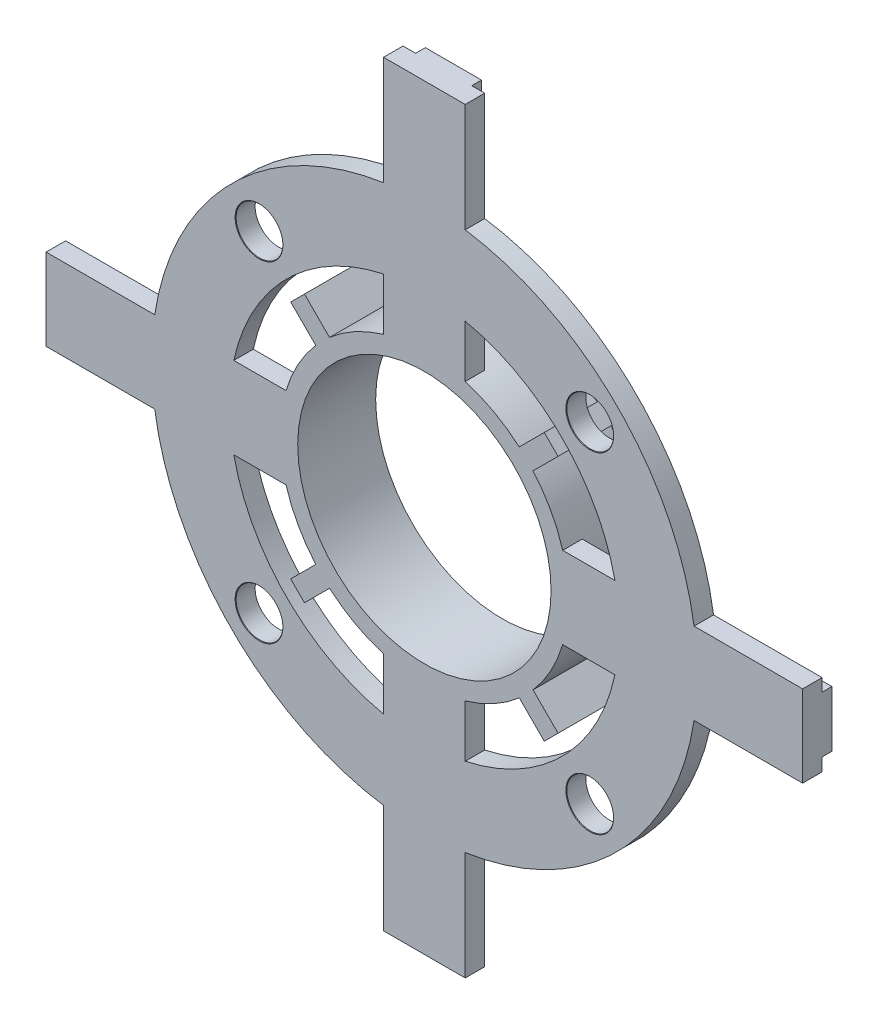
from build123d import *

# Parameters (mm, degrees)
BOSS_EXTRUDE1_DEPTH            = 1.0000005
BOSS_EXTRUDE1_DEPTH_BACK       = 3
SKETCH1_R                      = 7.4
SKETCH1_R_2                    = 6.5
BOSS_EXTRUDE2_DEPTH            = 1.0000005
BOSS_EXTRUDE12_START           = -3
BOSS_EXTRUDE12_DEPTH           = 4.000001
SKETCH6_W                      = 2.880295876
SKETCH6_H                      = 10.5
BOSS_EXTRUDE8_DEPTH            = 0.5
CIRPATTERN3_COUNT              = 4
SKETCH7_R                      = 14
SKETCH7_R_2                    = 10
BOSS_EXTRUDE10_DEPTH           = 1.0000005
M2_CLEARANCE_HOLE1_D           = 2.4
M2_CLEARANCE_HOLE1_CSINK_D     = 2.45
M2_CLEARANCE_HOLE1_CSINK_ANGLE = 90
CUT_EXTRUDE1_DEPTH             = 28.738141627


with BuildPart() as part:
    # Sketch1 → Boss-Extrude1 (new, two sides: drawn at the far end of the back side and taken through both)
    with BuildSketch(Plane.XY.offset(-BOSS_EXTRUDE1_DEPTH_BACK)):
        Circle(SKETCH1_R)
        Circle(SKETCH1_R_2, mode=Mode.SUBTRACT)
    extrude(amount=BOSS_EXTRUDE1_DEPTH + BOSS_EXTRUDE1_DEPTH_BACK)

    # Sketch2 → Boss-Extrude2 (add)
    with BuildSketch(Plane.XY.offset(1.0000005)):
        with BuildLine():
            ThreePointArc((2.0955, -15.598818832), (6.979767945, -14.106633498), (11.129112031, -11.129112031))
            ThreePointArc((11.129112031, -11.129112031), (14.106633498, -6.979767945), (15.598818832, -2.0955))
            Line((15.598818832, -2.0955), (19.408818832, -2.0955))
            Line((19.408818832, -2.0955), (19.408818832, 2.0955))
            Line((19.408818832, 2.0955), (15.598818832, 2.0955))
            ThreePointArc((15.598818832, 2.0955), (11.129112031, 11.129112031), (2.0955, 15.598818832))
            Line((2.0955, 15.598818832), (2.0955, 19.408818832))
            Line((2.0955, 19.408818832), (-2.0955, 19.408818832))
            Line((-2.0955, 19.408818832), (-2.0955, 15.598818832))
            ThreePointArc((-2.0955, 15.598818832), (-11.129112031, 11.129112031), (-15.598818832, 2.0955))
            Line((-15.598818832, 2.0955), (-19.408818832, 2.0955))
            Line((-19.408818832, 2.0955), (-19.408818832, -2.0955))
            Line((-19.408818832, -2.0955), (-15.598818832, -2.0955))
            ThreePointArc((-15.598818832, -2.0955), (-11.129112031, -11.129112031), (-2.0955, -15.598818832))
            Line((-2.0955, -15.598818832), (-2.0955, -19.408818832))
            Line((-2.0955, -19.408818832), (2.0955, -19.408818832))
            Line((2.0955, -19.408818832), (2.0955, -15.598818832))
        make_face()
        with BuildLine():
            ThreePointArc((7.4, 0), (7.323884446, -1.05863904), (7.097103617, -2.0955))
            Line((7.097103617, -2.0955), (13.031535896, -2.0955))
            ThreePointArc((13.031535896, -2.0955), (11.753270525, -6.006053615), (9.333060807, -9.333060807))
            ThreePointArc((9.333060807, -9.333060807), (6.006053615, -11.753270525), (2.0955, -13.031535896))
            Line((2.0955, -13.031535896), (2.0955, -7.097103617))
            ThreePointArc((2.0955, -7.097103617), (0, -7.4), (-2.0955, -7.097103617))
            Line((-2.0955, -7.097103617), (-2.0955, -13.031535896))
            ThreePointArc((-2.0955, -13.031535896), (-9.333060807, -9.333060807), (-13.031535896, -2.0955))
            Line((-13.031535896, -2.0955), (-7.097103617, -2.0955))
            ThreePointArc((-7.097103617, -2.0955), (-7.4, 0), (-7.097103617, 2.0955))
            Line((-7.097103617, 2.0955), (-13.031535896, 2.0955))
            ThreePointArc((-13.031535896, 2.0955), (-9.333060807, 9.333060807), (-2.0955, 13.031535896))
            Line((-2.0955, 13.031535896), (-2.0955, 7.097103617))
            ThreePointArc((-2.0955, 7.097103617), (0, 7.4), (2.0955, 7.097103617))
            Line((2.0955, 7.097103617), (2.0955, 13.031535896))
            ThreePointArc((2.0955, 13.031535896), (9.333060807, 9.333060807), (13.031535896, 2.0955))
            Line((13.031535896, 2.0955), (7.097103617, 2.0955))
            ThreePointArc((7.097103617, 2.0955), (7.323884446, 1.05863904), (7.4, 0))
        make_face(mode=Mode.SUBTRACT)
    extrude(amount=-BOSS_EXTRUDE2_DEPTH)

    # Sketch3 → Boss-Extrude12 (add)
    with BuildSketch(Plane.XY.offset(BOSS_EXTRUDE12_START)):
        with BuildLine():
            ThreePointArc((4.867078755, 5.574185536), (4.880275394, 5.562635354), (4.893444623, 5.551053929))
            ThreePointArc((4.893444623, 5.551053929), (5.244976244, 5.220174729), (5.574185536, 4.867078755))
            Line((5.574185536, 4.867078755), (6.858935778, 6.151828996))
            Line((6.858935778, 6.151828996), (6.151828996, 6.858935778))
            Line((6.151828996, 6.858935778), (4.867078755, 5.574185536))
        make_face()
        with BuildLine():
            ThreePointArc((-4.893444623, 5.551053929), (-4.880275394, 5.562635354), (-4.867078755, 5.574185536))
            Line((-4.867078755, 5.574185536), (-6.151828996, 6.858935778))
            Line((-6.151828996, 6.858935778), (-6.858935778, 6.151828996))
            Line((-6.858935778, 6.151828996), (-5.574185536, 4.867078755))
            ThreePointArc((-5.574185536, 4.867078755), (-5.244976244, 5.220174729), (-4.893444623, 5.551053929))
        make_face()
        with BuildLine():
            Line((6.858935778, -6.151828996), (5.574185536, -4.867078755))
            ThreePointArc((5.574185536, -4.867078755), (5.232590181, -5.232590181), (4.867078755, -5.574185536))
            Line((4.867078755, -5.574185536), (6.151828996, -6.858935778))
            Line((6.151828996, -6.858935778), (6.858935778, -6.151828996))
        make_face()
        with BuildLine():
            ThreePointArc((-4.867078755, -5.574185536), (-5.232590181, -5.232590181), (-5.574185536, -4.867078755))
            Line((-5.574185536, -4.867078755), (-6.858935778, -6.151828996))
            Line((-6.858935778, -6.151828996), (-6.151828996, -6.858935778))
            Line((-6.151828996, -6.858935778), (-4.867078755, -5.574185536))
        make_face()
    extrude(amount=BOSS_EXTRUDE12_DEPTH)

    # Sketch6 → Boss-Extrude8 (add)
    with BuildSketch(Plane(origin=(0, 0, 0), x_dir=(-1, 0, 0), z_dir=(0, 0, -1))):
        with Locations((0.009852062, 14.158818832)):
            Rectangle(SKETCH6_W, SKETCH6_H)
    boss_extrude8 = extrude(amount=BOSS_EXTRUDE8_DEPTH)

    # CirPattern3: Boss-Extrude8 ×4 about axis
    cirpattern3_axis = Axis((0, 0, 0), (0, 0, 1))
    for i in range(1, CIRPATTERN3_COUNT):
        add(boss_extrude8.rotate(cirpattern3_axis, i * 360 / CIRPATTERN3_COUNT))

    # Sketch7 → Boss-Extrude10 (add)
    with BuildSketch(Plane.XY.offset(1.0000005)):
        Circle(SKETCH7_R)
        Circle(SKETCH7_R_2, mode=Mode.SUBTRACT)
    extrude(amount=-BOSS_EXTRUDE10_DEPTH)

    # M2 Clearance Hole1 (through all)
    with Locations(Plane.XY.offset(1.0000005)):
        with Locations((0, 0), (8.485, -8.485), (-8.485, 8.485), (-8.485, -8.485), (8.485, 8.485)):
            CounterSinkHole(M2_CLEARANCE_HOLE1_D / 2, M2_CLEARANCE_HOLE1_CSINK_D / 2, counter_sink_angle=M2_CLEARANCE_HOLE1_CSINK_ANGLE)

    # Sketch10 → Cut-Extrude1 (cut, through all)
    with BuildSketch(Plane.XY.offset(1.0000005)):
        with BuildLine():
            ThreePointArc((-2.0955, 13.83682648), (-9.895678028, 9.895678028), (-13.83682648, 2.0955))
            Line((-13.83682648, 2.0955), (-20.600743229, 2.0955))
            ThreePointArc((-20.600743229, 2.0955), (-14.335944494, 14.286228168), (-2.0955, 20.453324327))
            Line((-2.0955, 20.453324327), (-2.0955, 13.83682648))
        make_face()
        with BuildLine():
            ThreePointArc((13.83682648, 2.0955), (9.895678028, 9.895678028), (2.0955, 13.83682648))
            Line((2.0955, 13.83682648), (2.0955, 20.453324327))
            ThreePointArc((2.0955, 20.453324327), (15.477172624, 15.2424301), (21.254785436, 2.0955))
            Line((21.254785436, 2.0955), (13.83682648, 2.0955))
        make_face()
        with BuildLine():
            ThreePointArc((-2.0955, -21.163548472), (-15.297243757, -15.462085596), (-20.600743229, -2.0955))
            Line((-20.600743229, -2.0955), (-13.83682648, -2.0955))
            ThreePointArc((-13.83682648, -2.0955), (-9.895678028, -9.895678028), (-2.0955, -13.83682648))
            Line((-2.0955, -13.83682648), (-2.0955, -21.163548472))
        make_face()
        with BuildLine():
            ThreePointArc((2.0955, -13.83682648), (9.895678028, -9.895678028), (13.83682648, -2.0955))
            Line((13.83682648, -2.0955), (21.254785436, -2.0955))
            ThreePointArc((21.254785436, -2.0955), (15.624264861, -15.597542172), (2.0955, -21.163548472))
            Line((2.0955, -21.163548472), (2.0955, -13.83682648))
        make_face()
    extrude(amount=-CUT_EXTRUDE1_DEPTH, mode=Mode.SUBTRACT)


solid = part.part
